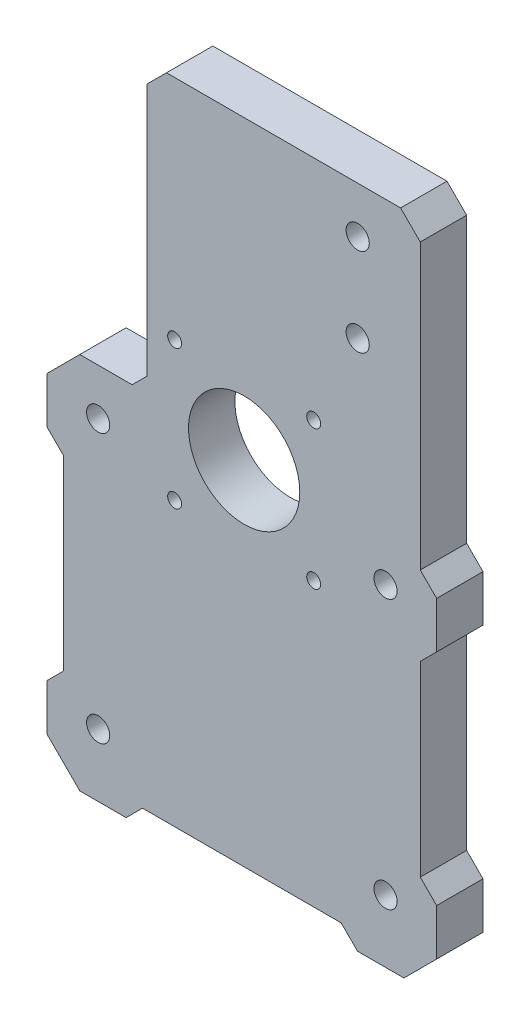
from build123d import *

# Parameters (mm, degrees)
CROQUIS1_R              = 2.5
SALIENTE_EXTRUIR1_DEPTH = 10
SALIENTE_EXTRUIR2_DEPTH = 10
CROQUIS10_R             = 2.5
CROQUIS10_R_2           = 12
CROQUIS10_R_3           = 1.5
CORTAR_EXTRUIR1_DEPTH   = 110.854385942


with BuildPart() as part:
    # Croquis1 → Saliente-Extruir1 (new body)
    with BuildSketch(Plane.XY):
        Polygon((-20.5, 39), (-38.5, 39), (-38.5, -39), (38.5, -39), (38.5, 96.757359313), (34.257359313, 101), (-16.257359313, 101), (-20.5, 96.757359313), align=None)
        with Locations((31, 29)):
            Circle(CROQUIS1_R, mode=Mode.SUBTRACT)
        with Locations((31, -29)):
            Circle(CROQUIS1_R, mode=Mode.SUBTRACT)
        with Locations((-31, -29)):
            Circle(CROQUIS1_R, mode=Mode.SUBTRACT)
        with Locations((-31, 29)):
            Circle(CROQUIS1_R, mode=Mode.SUBTRACT)
    extrude(amount=SALIENTE_EXTRUIR1_DEPTH)

    # Croquis9 → Saliente-Extruir2 (add, through all)
    with BuildSketch(Plane.XY.offset(10)):
        Polygon((-38.5, 35.464466094), (-38.5, 18.393398282), (-34.964466094, 39), align=None)
        Polygon((-42.035533906, 21.928932188), (-38.5, 18.393398282), (-38.5, 35.464466094), (-42.035533906, 31.928932188), align=None)
        Polygon((34.964466094, 39), (38.5, 18.393398282), (38.5, 35.464466094), align=None)
        Polygon((38.5, 35.464466094), (38.5, 18.393398282), (42.035533906, 21.928932188), (42.035533906, 31.928932188), align=None)
        Polygon((38.5, -21.928932188), (38.5, -30.464466094), (38.5, -39), (42.035533906, -35.464466094), (42.035533906, -25.464466094), align=None)
        Polygon((29.964466094, -39), (21.428932188, -39), (24.964466094, -42.535533906), (34.964466094, -42.535533906), (38.5, -39), align=None)
        Polygon((38.5, -30.464466094), (29.964466094, -39), (38.5, -39), align=None)
        Polygon((-38.5, -39), (-38.5, -30.464466094), (-38.5, -21.928932188), (-42.035533906, -25.464466094), (-42.035533906, -35.464466094), align=None)
        Polygon((-38.5, -39), (-29.964466094, -39), (-38.5, -30.464466094), align=None)
        Polygon((-24.964466094, -42.535533906), (-21.428932188, -39), (-29.964466094, -39), (-38.5, -39), (-34.964466094, -42.535533906), align=None)
        Polygon((-20.5, 42.168004936), (-23.668004936, 39), (-20.5, 39), align=None)
    extrude(amount=-SALIENTE_EXTRUIR2_DEPTH)

    # Croquis10 → Cortar-Extruir1 (cut, through all)
    with BuildSketch(Plane.XY.offset(10)):
        Polygon((-38.5, 39), (-38.5, 35.464466094), (-34.964466094, 39), align=None)
        with Locations((25, 72)):
            Circle(CROQUIS10_R)
        with Locations((25, 91)):
            Circle(CROQUIS10_R)
        with Locations((0.5, 37)):
            Circle(CROQUIS10_R_2)
        with Locations((-14.5, 52)):
            Circle(CROQUIS10_R_3)
        with Locations((15.5, 52)):
            Circle(CROQUIS10_R_3)
        with Locations((15.5, 22)):
            Circle(CROQUIS10_R_3)
        with Locations((-14.5, 22)):
            Circle(CROQUIS10_R_3)
    extrude(amount=-CORTAR_EXTRUIR1_DEPTH, mode=Mode.SUBTRACT)


solid = part.part
